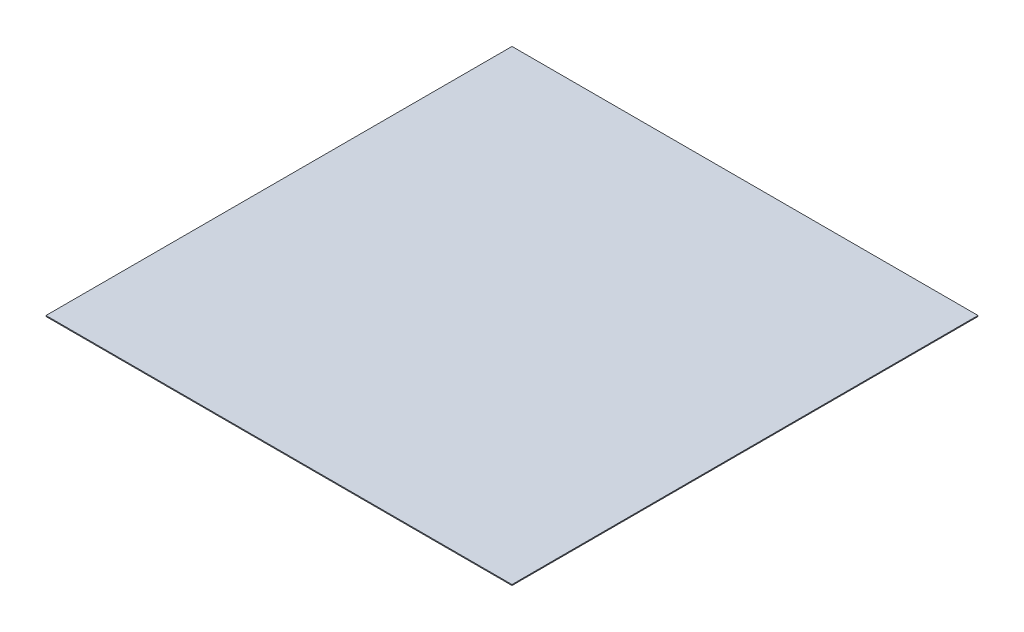
from build123d import *

# Parameters (mm, degrees)
SKETCH1_W           = 1000
SKETCH1_H           = 1000
BOSS_EXTRUDE1_DEPTH = 2


with BuildPart() as part:
    # Sketch1 → Boss-Extrude1 (new body)
    with BuildSketch(Plane(origin=(0, 0, 0), x_dir=(1, 0, 0), z_dir=(0, 1, 0))):
        with Locations((500, 500)):
            Rectangle(SKETCH1_W, SKETCH1_H)
    extrude(amount=BOSS_EXTRUDE1_DEPTH)


solid = part.part
